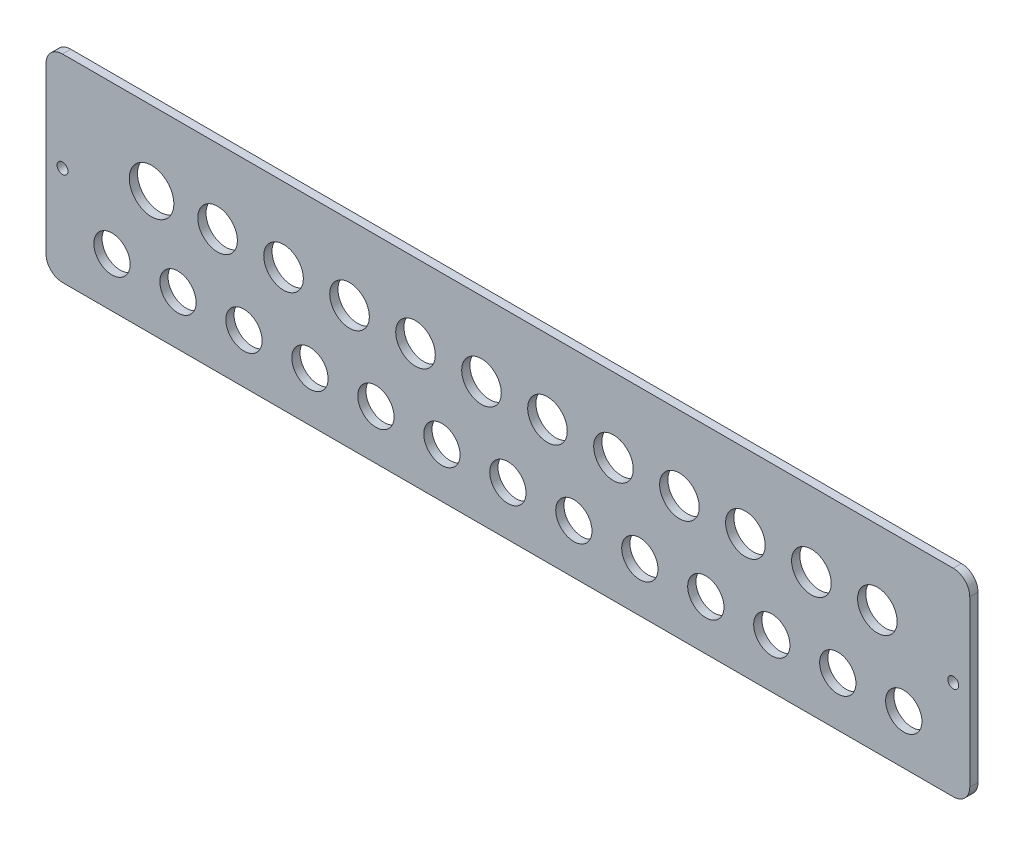
from build123d import *

# Parameters (mm, degrees)
BOSS_EXTRUDE1_DEPTH       = 5
M6_CLEARANCE_HOLE1_D      = 6.6
M6_CLEARANCE_HOLE1_DEPTH  = 6
M6_CLEARANCE_HOLE1_TIP    = 1.982840043
LPATTERN1_COUNT           = 13
LPATTERN1_PITCH           = 40
LPATTERN2_COUNT           = 12
LPATTERN2_PITCH           = 40
M25_CLEARANCE_HOLE1_D     = 27
M25_CLEARANCE_HOLE1_DEPTH = 6
M25_CLEARANCE_HOLE1_TIP   = 8.111618357


with BuildPart() as part:
    # Sketch1 → Boss-Extrude1 (new body)
    with BuildSketch(Plane.XY):
        with BuildLine():
            Line((-270, -60), (270, -60))
            ThreePointArc((270, -60), (277.071067812, -57.071067812), (280, -50))
            Line((280, -50), (280, 50))
            ThreePointArc((280, 50), (277.071067812, 57.071067812), (270, 60))
            Line((270, 60), (-270, 60))
            ThreePointArc((-270, 60), (-277.071067812, 57.071067812), (-280, 50))
            Line((-280, 50), (-280, -50))
            ThreePointArc((-280, -50), (-277.071067812, -57.071067812), (-270, -60))
        make_face()
    extrude(amount=BOSS_EXTRUDE1_DEPTH)

    # M6 Clearance Hole1
    with Locations(Plane.XY.offset(5)):
        with Locations((270, 0), (-270, 0)):
            Hole(M6_CLEARANCE_HOLE1_D / 2, depth=M6_CLEARANCE_HOLE1_DEPTH)
            with Locations((0, 0, -(M6_CLEARANCE_HOLE1_DEPTH + M6_CLEARANCE_HOLE1_TIP / 2))):  # 118° drill point
                Cone(0, M6_CLEARANCE_HOLE1_D / 2, M6_CLEARANCE_HOLE1_TIP, mode=Mode.SUBTRACT)

    # Sketch4 → M20 Clearance Hole1 (revolve, cut)
    with BuildSketch(Plane(origin=(240, -30, 0), x_dir=(0, 1, 0), z_dir=(1, 0, 0))):
        Polygon((0, 0), (0, 12.609466809), (11, 6), (11, 0), align=None)
    m20_clearance_hole1 = revolve(axis=Axis((240, -30, -6.35), (0, 0, 1)), mode=Mode.SUBTRACT)

    # LPattern1: M20 Clearance Hole1 ×13
    with Locations(*[(-i * LPATTERN1_PITCH, 0, 0) for i in range(1, LPATTERN1_COUNT)]):
        add(m20_clearance_hole1, mode=Mode.SUBTRACT)

    # Sketch6 → M22 Clearance Hole1 (revolve, cut)
    with BuildSketch(Plane(origin=(224, 15, 0), x_dir=(0, 1, 0), z_dir=(1, 0, 0))):
        Polygon((0, 0), (0, 13.210327428), (12, 6), (12, 0), align=None)
    m22_clearance_hole1 = revolve(axis=Axis((224, 15, -6.35), (0, 0, 1)), mode=Mode.SUBTRACT)

    # LPattern2: M22 Clearance Hole1 ×12
    with Locations(*[(-i * LPATTERN2_PITCH, 0, 0) for i in range(1, LPATTERN2_COUNT)]):
        add(m22_clearance_hole1, mode=Mode.SUBTRACT)

    # M25 Clearance Hole1
    with Locations(Plane(origin=(0, 0, 0), x_dir=(-1, 0, 0), z_dir=(0, 0, -1))):
        with Locations((216, 15)):
            Hole(M25_CLEARANCE_HOLE1_D / 2, depth=M25_CLEARANCE_HOLE1_DEPTH)
            with Locations((0, 0, -(M25_CLEARANCE_HOLE1_DEPTH + M25_CLEARANCE_HOLE1_TIP / 2))):  # 118° drill point
                Cone(0, M25_CLEARANCE_HOLE1_D / 2, M25_CLEARANCE_HOLE1_TIP, mode=Mode.SUBTRACT)


solid = part.part
